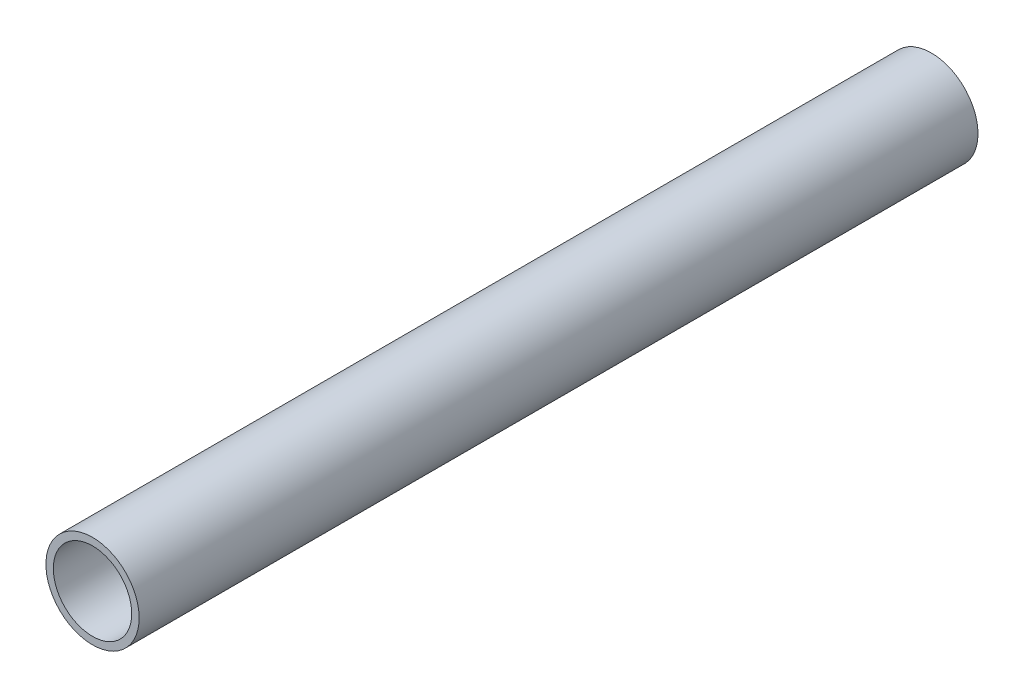
from build123d import *

# Parameters (mm, degrees)
SKETCH1_R           = 50.8
SKETCH1_R_2         = 42.7355
BOSS_EXTRUDE1_DEPTH = 914.4


with BuildPart() as part:
    # Sketch1 → Boss-Extrude1 (new body)
    with BuildSketch(Plane.XY):
        Circle(SKETCH1_R)
        Circle(SKETCH1_R_2, mode=Mode.SUBTRACT)
    extrude(amount=BOSS_EXTRUDE1_DEPTH)


solid = part.part
